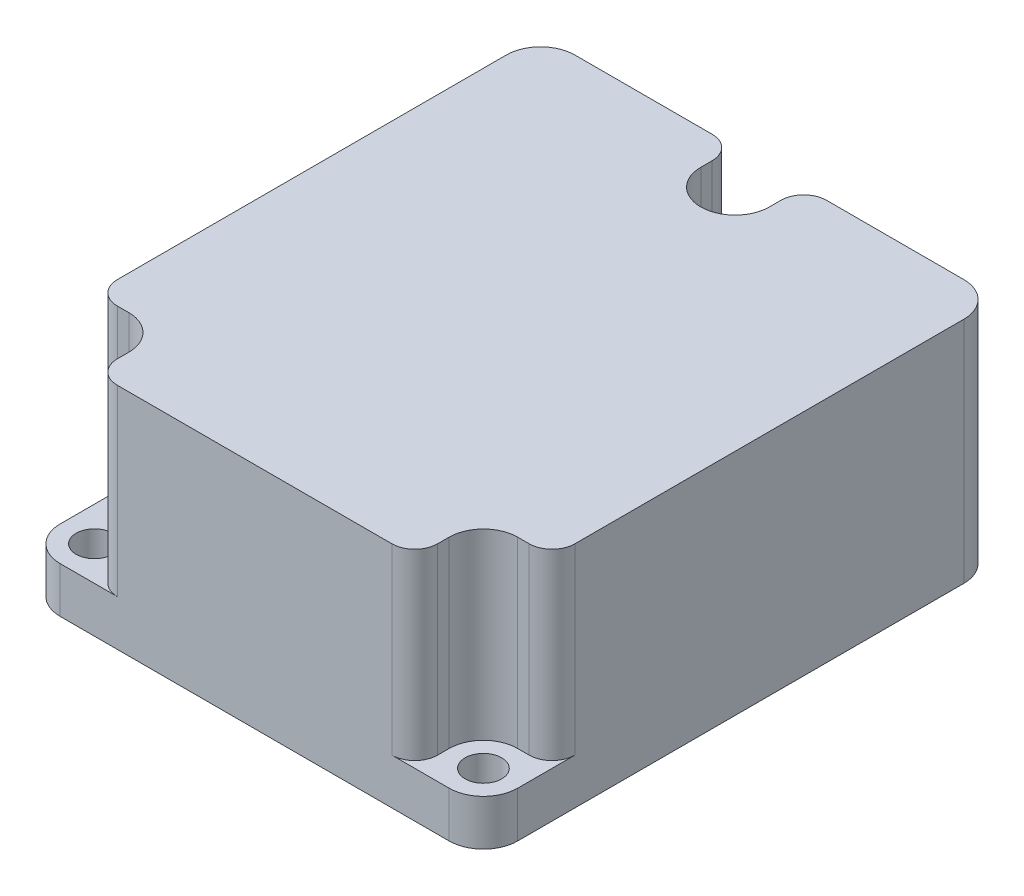
from build123d import *

# Parameters (mm, degrees)
SKETCH_1_R          = 1.6
EXTRUDE_1_DEPTH     = 20
CUT_EXTRUDE_START   = -16
SKETCH_2_R          = 1.6
CUT_EXTRUDE_1_DEPTH = 16
FILLET_1_R          = 2
SKETCH_3_R          = 7
EXTRUDE_2_DEPTH     = 50
CUT_EXTRUDE_START_2 = -50
SKETCH_4_R          = 7
CUT_EXTRUDE_2_DEPTH = 50


with BuildPart() as part:
    # 草图1 → 凸台-拉伸1 (new body)
    with BuildSketch(Plane(origin=(0, 0, 0), x_dir=(1, 0, 0), z_dir=(0, 1, 0))):
        with BuildLine():
            Line((3, 0), (37, 0))
            ThreePointArc((37, 0), (39.121320344, -0.878679656), (40, -3))
            Line((40, -3), (40, -42))
            ThreePointArc((40, -42), (39.121320344, -44.121320344), (37, -45))
            Line((37, -45), (3, -45))
            ThreePointArc((3, -45), (0.878679656, -44.121320344), (0, -42))
            Line((0, -42), (0, -3))
            ThreePointArc((0, -3), (0.878679656, -0.878679656), (3, 0))
        make_face()
        with Locations(Location((20, -3, 0), (0, 0, 270))):
            Circle(SKETCH_1_R, mode=Mode.SUBTRACT)
        with Locations(Location((3, -42, 0), (0, 0, 270))):
            Circle(SKETCH_1_R, mode=Mode.SUBTRACT)
        with Locations(Location((37, -42, 0), (0, 0, 270))):
            Circle(SKETCH_1_R, mode=Mode.SUBTRACT)
    extrude(amount=EXTRUDE_1_DEPTH)

    # 草图2 → 切除-拉伸1 (cut)
    # profile 1 of 3: a face of its own
    with BuildSketch(Plane(origin=(0, 20, 0), x_dir=(1, 0, 0), z_dir=(0, 1, 0)).offset(CUT_EXTRUDE_START)):
        with BuildLine():
            Line((40, -42), (40, -39))
            Line((40, -39), (37, -39))
            ThreePointArc((37, -39), (34.878679656, -39.878679656), (34, -42))
            Line((34, -42), (34, -45))
            Line((34, -45), (37, -45))
            ThreePointArc((37, -45), (39.121320344, -44.121320344), (40, -42))
        make_face()
        with Locations(Location((37, -42, 0), (0, 0, 270))):
            Circle(SKETCH_2_R, mode=Mode.SUBTRACT)
    # profile 2 of 3: a face of its own
    with BuildSketch(Plane(origin=(0, 20, 0), x_dir=(1, 0, 0), z_dir=(0, 1, 0)).offset(CUT_EXTRUDE_START)):
        with BuildLine():
            Line((3, -39), (0, -39))
            Line((0, -39), (0, -42))
            ThreePointArc((0, -42), (0.878679656, -44.121320344), (3, -45))
            Line((3, -45), (6, -45))
            Line((6, -45), (6, -42))
            ThreePointArc((6, -42), (5.121320344, -39.878679656), (3, -39))
        make_face()
        with Locations(Location((3, -42, 0), (0, 0, 270))):
            Circle(SKETCH_2_R, mode=Mode.SUBTRACT)
    # profile 3 of 3: a face of its own
    with BuildSketch(Plane(origin=(0, 20, 0), x_dir=(1, 0, 0), z_dir=(0, 1, 0)).offset(CUT_EXTRUDE_START)):
        with BuildLine():
            Line((17, 0), (17, -3))
            ThreePointArc((17, -3), (20, -6), (23, -3))
            Line((23, -3), (23, 0))
            Line((23, 0), (17, 0))
        make_face()
        with Locations(Location((20, -3, 0), (0, 0, 270))):
            Circle(SKETCH_2_R, mode=Mode.SUBTRACT)
    extrude(amount=CUT_EXTRUDE_1_DEPTH, mode=Mode.SUBTRACT)

    # 圆角1
    fillet_1_edges = [part.edges().sort_by_distance(p)[0] for p in [
        (40, 12, 39),
        (34, 12, 45),
        (6, 12, 45),
        (0, 12, 39),
        (17, 12, 0),
        (23, 12, 0),
    ]]
    fillet(fillet_1_edges, radius=FILLET_1_R)

    # 草图3 → 凸台-拉伸2 (add)
    with BuildSketch(Plane.XY.offset(45)):
        with Locations(Location((20, 10, 0), (0, 0, 180))):
            Circle(SKETCH_3_R)
    extrude(amount=EXTRUDE_2_DEPTH)

    # 草图4 → 切除-拉伸2 (cut)
    with BuildSketch(Plane.XY.offset(95).offset(CUT_EXTRUDE_START_2)):
        with Locations((20, 10)):
            Circle(SKETCH_4_R)
    extrude(amount=CUT_EXTRUDE_2_DEPTH, mode=Mode.SUBTRACT)


solid = part.part
